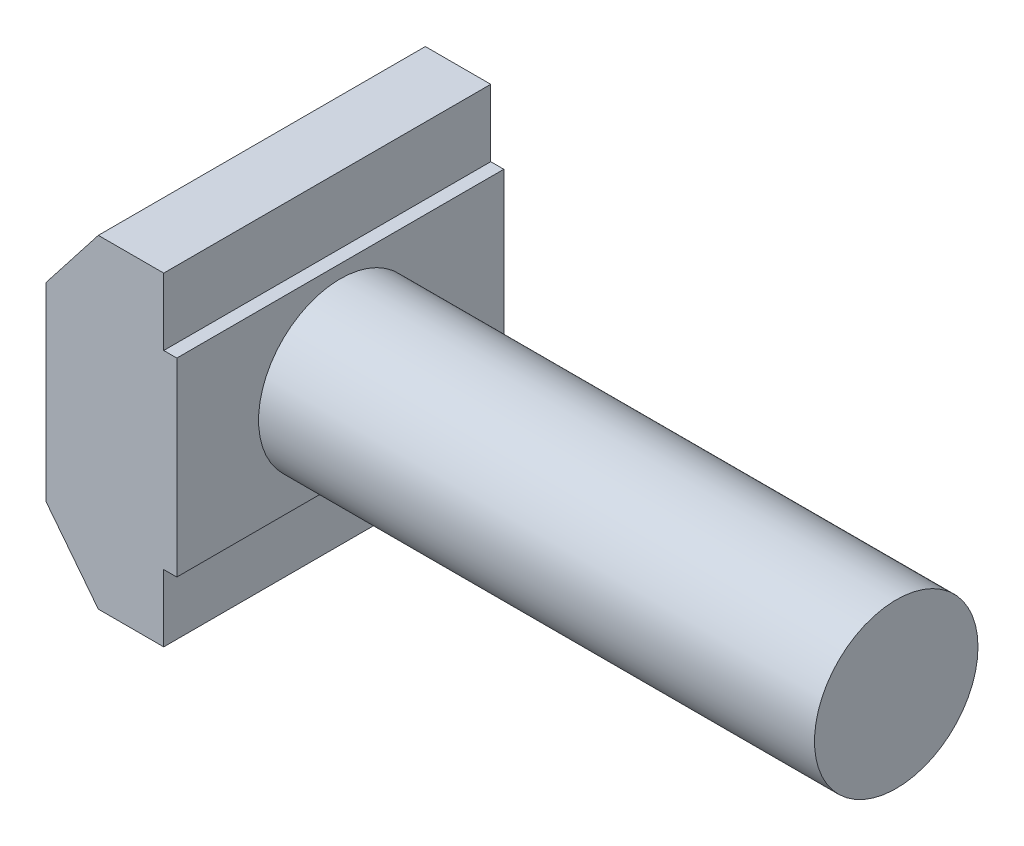
from build123d import *

# Parameters (mm, degrees)
BOSS_EXTRUDE1_DEPTH = 5
SKETCH2_R           = 2.5
BOSS_EXTRUDE2_DEPTH = 17


with BuildPart() as part:
    # Sketch1 → Boss-Extrude1 (new, symmetric)
    with BuildSketch(Plane.XY):
        Polygon((0, -2.9), (0, 2.9), (-0.4, 2.9), (-0.4, 4.95), (-2.4, 4.95), (-4, 2.9), (-4, -2.9), (-2.4, -4.95), (-0.4, -4.95), (-0.4, -2.9), align=None)
    extrude(amount=BOSS_EXTRUDE1_DEPTH, both=True)

    # Sketch2 → Boss-Extrude2 (add)
    with BuildSketch(Plane(origin=(0, 0, 0), x_dir=(0, 0, -1), z_dir=(1, 0, 0))):
        Circle(SKETCH2_R)
    extrude(amount=BOSS_EXTRUDE2_DEPTH)


solid = part.part
